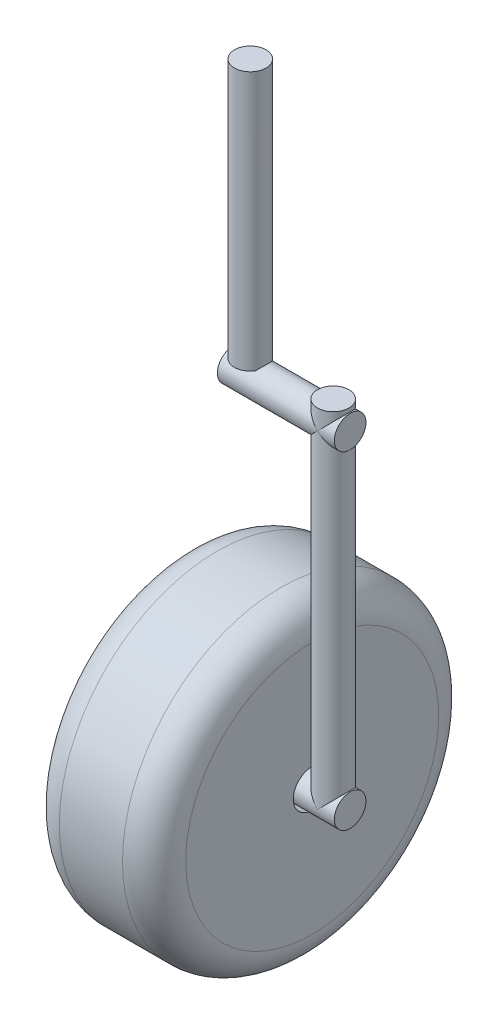
from build123d import *

# Parameters (mm, degrees)
SKETCH1_R                = 5
SKETCH1_R_2              = 0.6
BOSS_EXTRUDE1_DEPTH      = 4
FILLET1_R                = 1
FILLET2_R                = 1
BOSS_EXTRUDE2_DEPTH      = 5.2
BOSS_EXTRUDE2_DEPTH_BACK = 0.5
SKETCH2_R                = 0.5
SKETCH3_R                = 0.5
BOSS_EXTRUDE3_DEPTH      = 11
SKETCH5_R                = 0.5
BOSS_EXTRUDE4_DEPTH      = 5.2
BOSS_EXTRUDE6_DEPTH      = 3
BOSS_EXTRUDE6_DEPTH_BACK = 5.2
SKETCH7_R                = 0.5
SKETCH8_W                = 7.726432721
SKETCH8_H                = 3.897197193
CUT_EXTRUDE1_DEPTH       = 1.5


with BuildPart() as part:
    # Sketch1 → Boss-Extrude1 (new body)
    with BuildSketch(Plane(origin=(0, 0, 0), x_dir=(0, 0, -1), z_dir=(1, 0, 0))):
        Circle(SKETCH1_R)
        Circle(SKETCH1_R_2, mode=Mode.SUBTRACT)
    extrude(amount=BOSS_EXTRUDE1_DEPTH)

    # Fillet1
    fillet1_edges = [part.edges().sort_by_distance(p)[0] for p in [
        (0, 0, 5),
    ]]
    fillet(fillet1_edges, radius=FILLET1_R)

    # Fillet2
    fillet2_edges = [part.edges().sort_by_distance(p)[0] for p in [
        (4, 0, 5),
    ]]
    fillet(fillet2_edges, radius=FILLET2_R)


with BuildPart() as body_2:
    # Sketch2 → Boss-Extrude2 (new, two sides: drawn at the far end of the back side and taken through both)
    with BuildSketch(Plane(origin=(0, 0, 0), x_dir=(0, 0, -1), z_dir=(1, 0, 0)).offset(-BOSS_EXTRUDE2_DEPTH_BACK)):
        Circle(SKETCH2_R)
    extrude(amount=BOSS_EXTRUDE2_DEPTH + BOSS_EXTRUDE2_DEPTH_BACK)

    # Sketch3 → Boss-Extrude3 (add)
    with BuildSketch(Plane(origin=(0, 0, 0), x_dir=(1, 0, 0), z_dir=(0, 1, 0))):
        with Locations(Location((4.664349938, 0, 0), (0, 0, 270))):
            Circle(SKETCH3_R)
    extrude(amount=BOSS_EXTRUDE3_DEPTH)

    # Sketch5 → Boss-Extrude4 (add)
    with BuildSketch(Plane(origin=(0, 0, 0), x_dir=(0, 0, -1), z_dir=(1, 0, 0))):
        with Locations((0, 10.37285766)):
            Circle(SKETCH5_R)
    extrude(amount=BOSS_EXTRUDE4_DEPTH)

    # Sketch7 → Boss-Extrude6 (add, two sides: drawn at the far end of the back side and taken through both)
    with BuildSketch(Plane(origin=(0, 16, 0), x_dir=(1, 0, 0), z_dir=(0, 1, 0)).offset(-BOSS_EXTRUDE6_DEPTH_BACK)):
        with Locations(Location((2.040329442, 0, 0), (0, 0, 270))):
            Circle(SKETCH7_R)
    extrude(amount=BOSS_EXTRUDE6_DEPTH + BOSS_EXTRUDE6_DEPTH_BACK)

    # Sketch8 → Cut-Extrude1 (cut)
    with BuildSketch(Plane.ZY):
        with Locations((-1.600922228, 9.943451596)):
            Rectangle(SKETCH8_W, SKETCH8_H)
    extrude(amount=-CUT_EXTRUDE1_DEPTH, mode=Mode.SUBTRACT)


solid = Compound([part.part, body_2.part])
